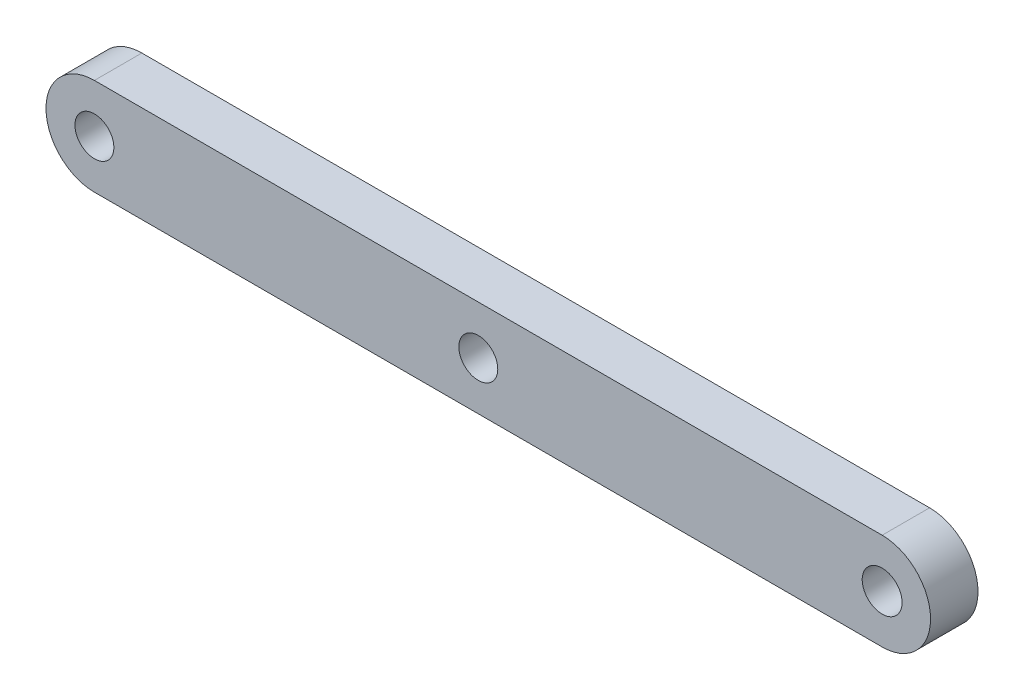
from build123d import *

# Parameters (mm, degrees)
ESQUISSE1_R        = 2.1
ESQUISSE1_R_2      = 2.05
BOSS_EXTRU_1_DEPTH = 5


with BuildPart() as part:
    # Esquisse1 → Boss.-Extru.1 (new body)
    with BuildSketch(Plane.XY):
        with BuildLine():
            Line((0, -5.1), (-83, -5.1))
            ThreePointArc((-83, -5.1), (-88.1, 0), (-83, 5.1))
            Line((-83, 5.1), (0, 5.1))
            ThreePointArc((0, 5.1), (5.1, 0), (0, -5.1))
        make_face()
        Circle(ESQUISSE1_R, mode=Mode.SUBTRACT)
        with Locations((-42.55, 0)):
            Circle(ESQUISSE1_R_2, mode=Mode.SUBTRACT)
        with Locations((-83, 0)):
            Circle(ESQUISSE1_R_2, mode=Mode.SUBTRACT)
    extrude(amount=BOSS_EXTRU_1_DEPTH)


solid = part.part
